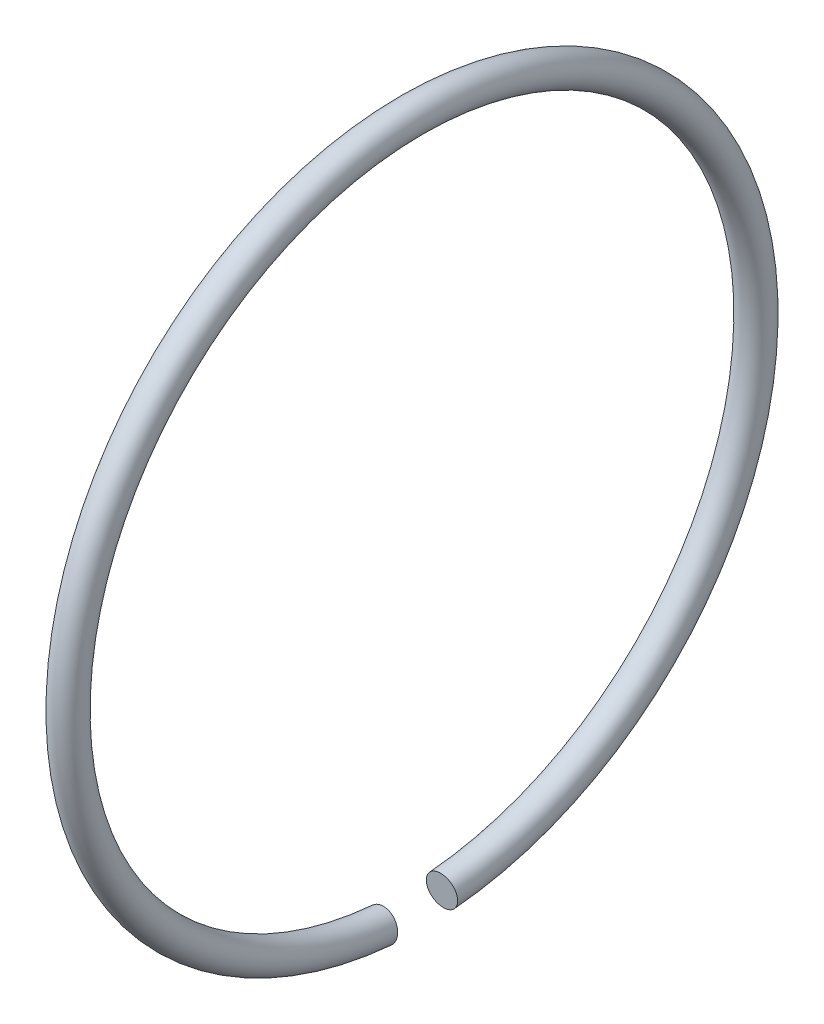
from build123d import *
from build123d.topology import SkipClean

# Parameters (mm, degrees)
SKETCH1_R                = 0.5
REVOLVE1_ANGLE           = 175
REVOLVE1_OTHER_WAY_ANGLE = 175


with BuildPart() as part:
    # Sketch1 → Revolve1 (revolve)
    with BuildSketch(Plane.XY):
        with Locations((0, 11)):
            Circle(SKETCH1_R)
    revolve(axis=Axis((0.5, 0, 0), (-1, 0, 0)), revolution_arc=REVOLVE1_ANGLE)

    # Sketch1 → Revolve1 other way (revolve)
    with SkipClean():  # the faces are left unmerged after this step: merging them gives an invalid solid
        with BuildSketch(Plane.XY):
            with Locations((0, 11)):
                Circle(SKETCH1_R)
        revolve(axis=Axis((0.5, 0, 0), (1, 0, 0)), revolution_arc=REVOLVE1_OTHER_WAY_ANGLE)


solid = part.part
